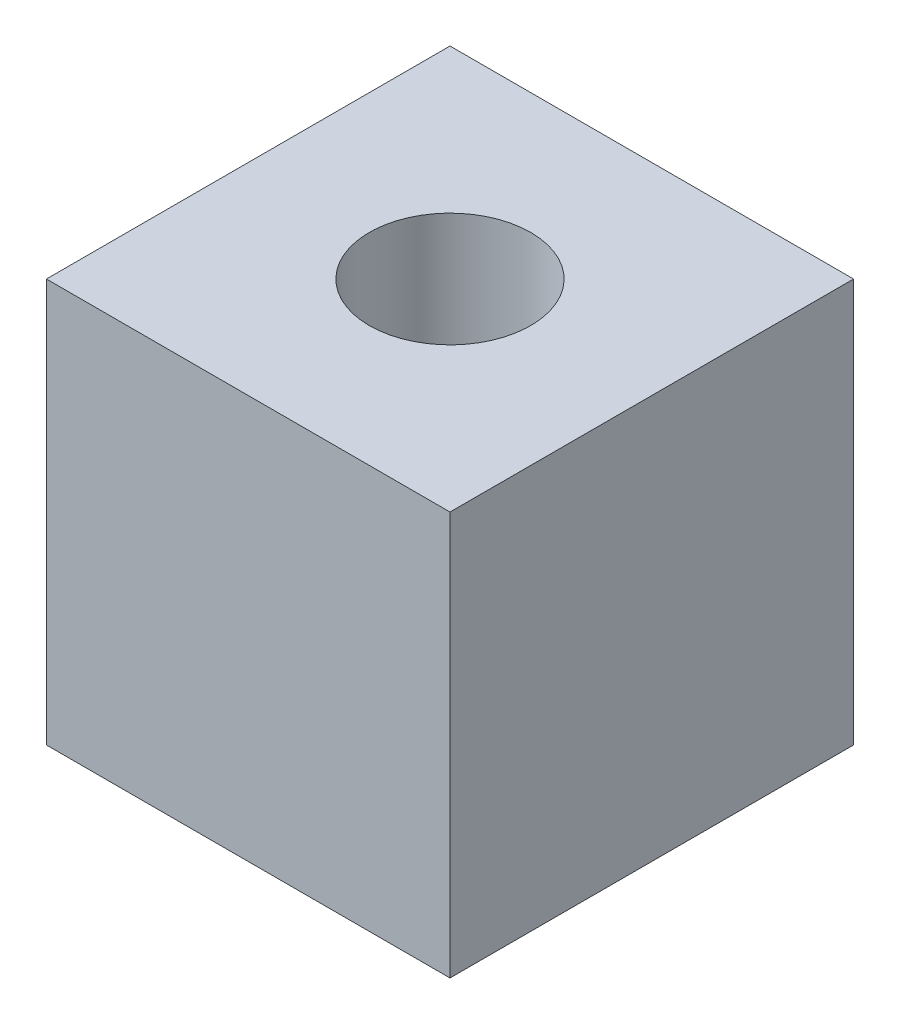
from build123d import *

# Parameters (mm, degrees)
SKETCH1_W           = 50
SKETCH1_H           = 50
SKETCH1_R           = 10
BOSS_EXTRUDE1_DEPTH = 50


with BuildPart() as part:
    # Sketch1 → Boss-Extrude1 (new body)
    with BuildSketch(Plane(origin=(0, 0, 0), x_dir=(1, 0, 0), z_dir=(0, 1, 0))):
        Rectangle(SKETCH1_W, SKETCH1_H)
        with Locations(Location((0, 0, 0), (0, 0, 270))):
            Circle(SKETCH1_R, mode=Mode.SUBTRACT)
    extrude(amount=BOSS_EXTRUDE1_DEPTH)


solid = part.part
